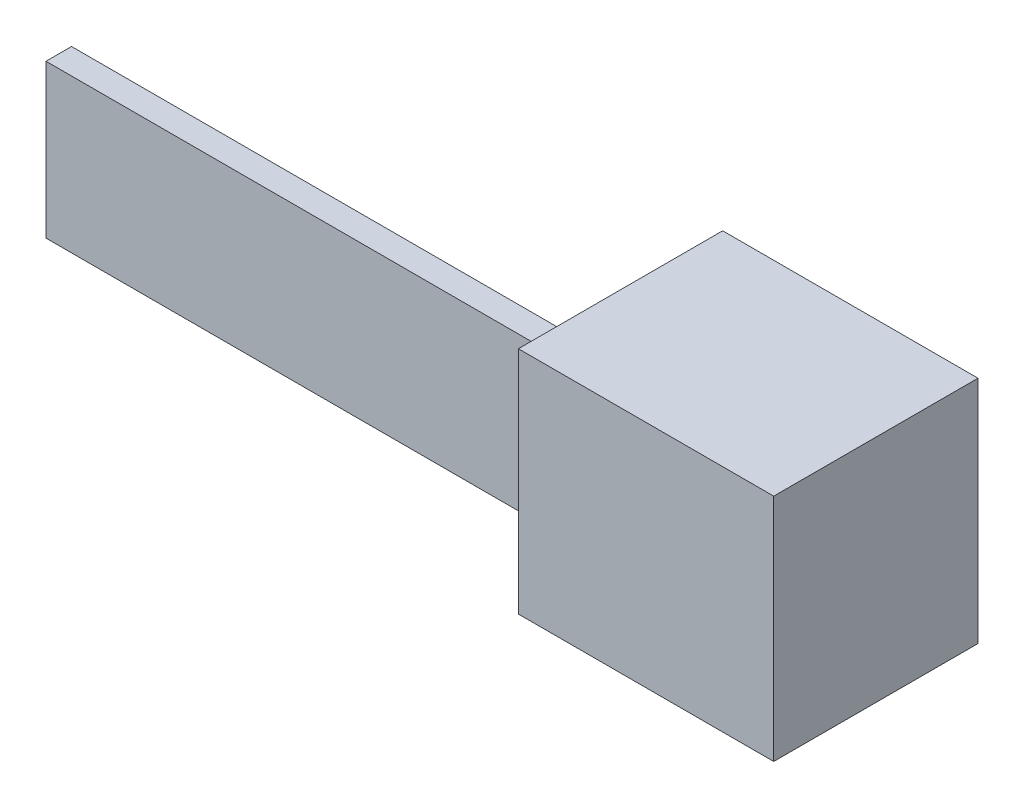
from build123d import *

# Parameters (mm, degrees)
SKETCH1_W           = 10
SKETCH1_H           = 8
SKETCH1_W_2         = 22
SKETCH1_H_2         = 1
BOSS_EXTRUDE1_DEPTH = 3
SKETCH2_W           = 10
SKETCH2_H           = 8
BOSS_EXTRUDE2_DEPTH = 3


with BuildPart() as part:
    # Sketch1 → Boss-Extrude1 (new, symmetric)
    with BuildSketch(Plane(origin=(0, 0, 0), x_dir=(1, 0, 0), z_dir=(0, 1, 0))):
        with Locations((5, 0)):
            Rectangle(SKETCH1_W, SKETCH1_H)
        with Locations((-11, 0)):
            Rectangle(SKETCH1_W_2, SKETCH1_H_2)
    extrude(amount=BOSS_EXTRUDE1_DEPTH, both=True)

    # Sketch2 → Boss-Extrude2 (add)
    with BuildSketch(Plane(origin=(0, 3, 0), x_dir=(1, 0, 0), z_dir=(0, 1, 0))):
        with Locations((5, 0)):
            Rectangle(SKETCH2_W, SKETCH2_H)
    extrude(amount=BOSS_EXTRUDE2_DEPTH)


solid = part.part
